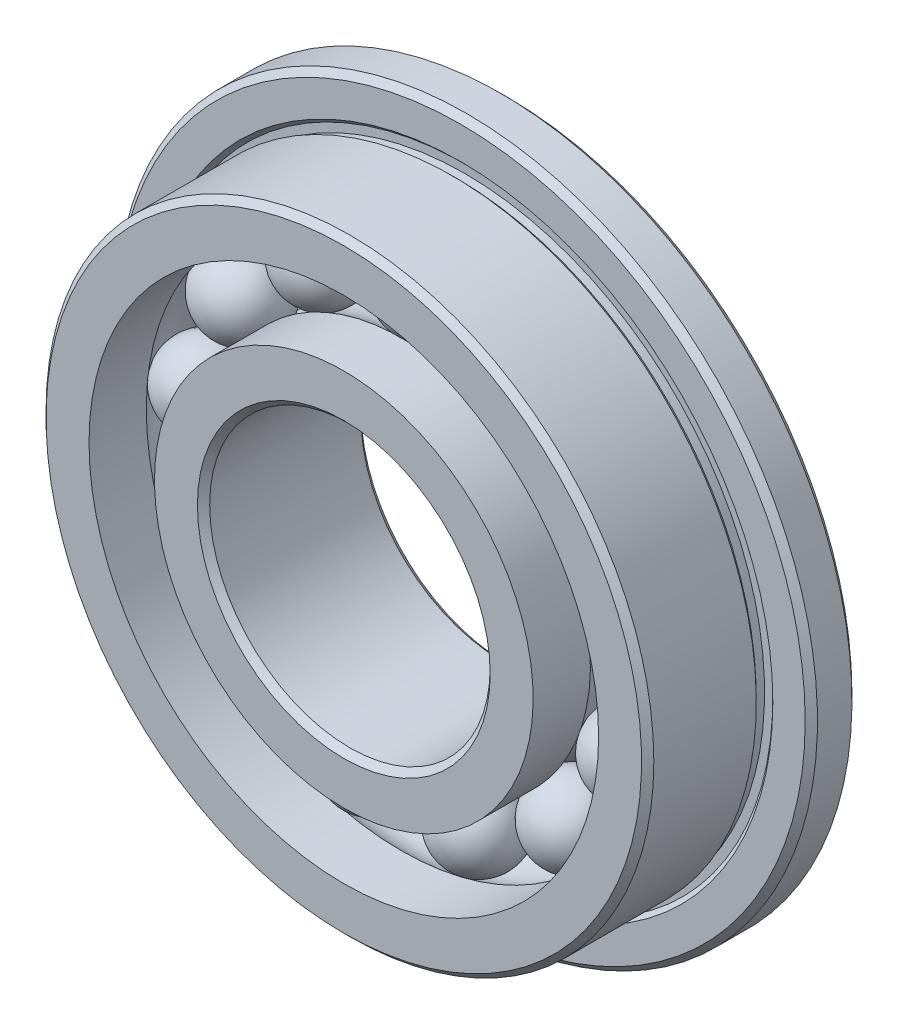
from build123d import *

# Parameters (mm, degrees)
FILLET1_SIZE      = 0.13125
FILLET2_SIZE      = 0.13125
CIRPATTERN3_COUNT = 13


with BuildPart() as part:
    # Sketch2 → Revolve1 (revolve)
    with BuildSketch(Plane(origin=(0, 0, 0), x_dir=(0, 0, -1), z_dir=(1, 0, 0)), mode=Mode.PRIVATE) as revolve1_sk:
        with BuildLine():
            Line((1.75, 7.5), (0.75, 7.5))
            Line((0.75, 7.5), (0.75, 6.676776695))
            Line((0.75, 6.676776695), (0.838388348, 6.588388348))
            Line((0.838388348, 6.588388348), (0.838388348, 6.411611652))
            Line((0.838388348, 6.411611652), (0.661611652, 6.411611652))
            Line((0.661611652, 6.411611652), (0.573223305, 6.5))
            Line((0.573223305, 6.5), (-1.75, 6.5))
            Line((-1.75, 6.5), (-1.75, 5.45))
            Line((-1.75, 5.45), (-0.525, 5.45))
            ThreePointArc((-0.525, 5.45), (0, 5.625), (0.525, 5.45))
            Line((0.525, 5.45), (1.75, 5.45))
            Line((1.75, 5.45), (1.75, 7.5))
        make_face()
        with BuildLine():
            Line((1.75, 3), (-1.75, 3))
            Line((-1.75, 3), (-1.75, 4.05))
            Line((-1.75, 4.05), (-0.525, 4.05))
            ThreePointArc((-0.525, 4.05), (0, 3.875), (0.525, 4.05))
            Line((0.525, 4.05), (1.75, 4.05))
            Line((1.75, 4.05), (1.75, 3))
        make_face()
    revolve(revolve1_sk.sketch.rotate(Axis((0, 0, 0), (0, 0, -1)), 180), axis=Axis((0, 0, 0), (0, 0, -1)))

    # Fillet1
    fillet1_edges = [part.edges().sort_by_distance(p)[0] for p in [
        (0, 6.5, 1.75),
        (0, 7.5, -1.75),
        (0, 7.5, -0.75),
    ]]
    chamfer(fillet1_edges, length=FILLET1_SIZE)

    # Fillet2
    fillet2_edges = [part.edges().sort_by_distance(p)[0] for p in [
        (0, 3, -1.75),
        (0, 3, 1.75),
    ]]
    chamfer(fillet2_edges, length=FILLET2_SIZE)


with BuildPart() as body_2:
    # Sketch7 → Revolve3 (revolve)
    with BuildSketch(Plane.XY):
        with BuildLine():
            Line((0, 5.625), (0, 3.875))
            ThreePointArc((0, 3.875), (-0.875, 4.75), (0, 5.625))
        make_face()
    revolve(axis=Axis((0, 5.625, 0), (0, -1, 0)))


with BuildPart() as cirpattern3_1:
    # CirPattern3: pattern copy
    add(body_2.part.rotate(Axis((0, 0, 0), (0, 0, 1)), 1 * 360 / CIRPATTERN3_COUNT))


with BuildPart() as cirpattern3_2:
    # CirPattern3: pattern copy
    add(body_2.part.rotate(Axis((0, 0, 0), (0, 0, 1)), 2 * 360 / CIRPATTERN3_COUNT))


with BuildPart() as cirpattern3_3:
    # CirPattern3: pattern copy
    add(body_2.part.rotate(Axis((0, 0, 0), (0, 0, 1)), 3 * 360 / CIRPATTERN3_COUNT))


with BuildPart() as cirpattern3_4:
    # CirPattern3: pattern copy
    add(body_2.part.rotate(Axis((0, 0, 0), (0, 0, 1)), 4 * 360 / CIRPATTERN3_COUNT))


with BuildPart() as cirpattern3_5:
    # CirPattern3: pattern copy
    add(body_2.part.rotate(Axis((0, 0, 0), (0, 0, 1)), 5 * 360 / CIRPATTERN3_COUNT))


with BuildPart() as cirpattern3_6:
    # CirPattern3: pattern copy
    add(body_2.part.rotate(Axis((0, 0, 0), (0, 0, 1)), 6 * 360 / CIRPATTERN3_COUNT))


with BuildPart() as cirpattern3_7:
    # CirPattern3: pattern copy
    add(body_2.part.rotate(Axis((0, 0, 0), (0, 0, 1)), 7 * 360 / CIRPATTERN3_COUNT))


with BuildPart() as cirpattern3_8:
    # CirPattern3: pattern copy
    add(body_2.part.rotate(Axis((0, 0, 0), (0, 0, 1)), 8 * 360 / CIRPATTERN3_COUNT))


with BuildPart() as cirpattern3_9:
    # CirPattern3: pattern copy
    add(body_2.part.rotate(Axis((0, 0, 0), (0, 0, 1)), 9 * 360 / CIRPATTERN3_COUNT))


with BuildPart() as cirpattern3_10:
    # CirPattern3: pattern copy
    add(body_2.part.rotate(Axis((0, 0, 0), (0, 0, 1)), 10 * 360 / CIRPATTERN3_COUNT))


with BuildPart() as cirpattern3_11:
    # CirPattern3: pattern copy
    add(body_2.part.rotate(Axis((0, 0, 0), (0, 0, 1)), 11 * 360 / CIRPATTERN3_COUNT))


with BuildPart() as cirpattern3_12:
    # CirPattern3: pattern copy
    add(body_2.part.rotate(Axis((0, 0, 0), (0, 0, 1)), 12 * 360 / CIRPATTERN3_COUNT))


solid = Compound([part.part, body_2.part, cirpattern3_1.part, cirpattern3_2.part, cirpattern3_3.part, cirpattern3_4.part, cirpattern3_5.part, cirpattern3_6.part, cirpattern3_7.part, cirpattern3_8.part, cirpattern3_9.part, cirpattern3_10.part, cirpattern3_11.part, cirpattern3_12.part])
